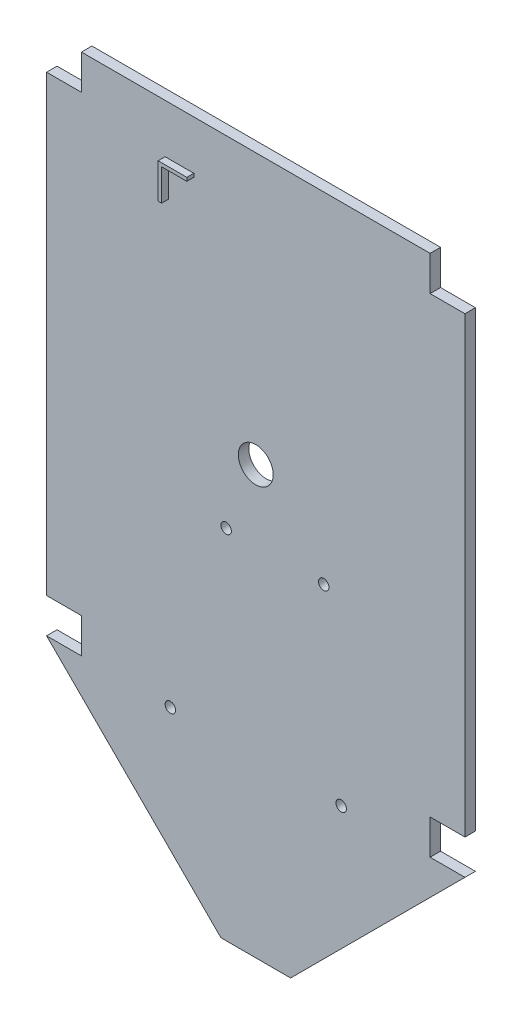
from build123d import *

# Parameters (mm, degrees)
EXTRUSION1_DEPTH        = 3
ESQUISSE2_R             = 1.5
ENL_V_MAT_EXTRU_1_DEPTH = 10
EXTRUSION2_DEPTH        = 2
ESQUISSE4_R             = 5
ENL_V_MAT_EXTRU_2_DEPTH = 52


with BuildPart() as part:
    # Esquisse1 → Extrusion1 (new body)
    with BuildSketch(Plane.XY):
        Polygon((50, 0), (-50, 0), (-50, -10), (-60, -10), (-60, -140), (-50, -140), (-50, -150), (-60, -150), (-10, -200), (10, -200), (60, -150), (50, -150), (50, -140), (60, -140), (60, -10), (50, -10), align=None)
    extrude(amount=EXTRUSION1_DEPTH)

    # Esquisse2 → Enlèv. mat.-Extru.1 (cut)
    with BuildSketch(Plane.XY.offset(3)):
        with Locations((-24.5, -150)):
            Circle(ESQUISSE2_R)
        with Locations((-8.5, -97.5)):
            Circle(ESQUISSE2_R)
        with Locations((19.5, -97.5)):
            Circle(ESQUISSE2_R)
        with Locations((24.5, -150)):
            Circle(ESQUISSE2_R)
    extrude(amount=-ENL_V_MAT_EXTRU_1_DEPTH, mode=Mode.SUBTRACT)

    # Esquisse3 → Extrusion2 (add)
    with BuildSketch(Plane.XY.offset(3)):
        Polygon((-25, -15), (-25, -24.03748446), (-26, -24.03748446), (-26, -14), (-17.773776224, -14), (-17.773776224, -15), align=None)
    extrude(amount=EXTRUSION2_DEPTH)

    # Esquisse4 → Enlèv. mat.-Extru.2 (cut)
    with BuildSketch(Plane.XY.offset(3)):
        with Locations((0, -77.5)):
            Circle(ESQUISSE4_R)
    extrude(amount=-ENL_V_MAT_EXTRU_2_DEPTH, mode=Mode.SUBTRACT)


solid = part.part
